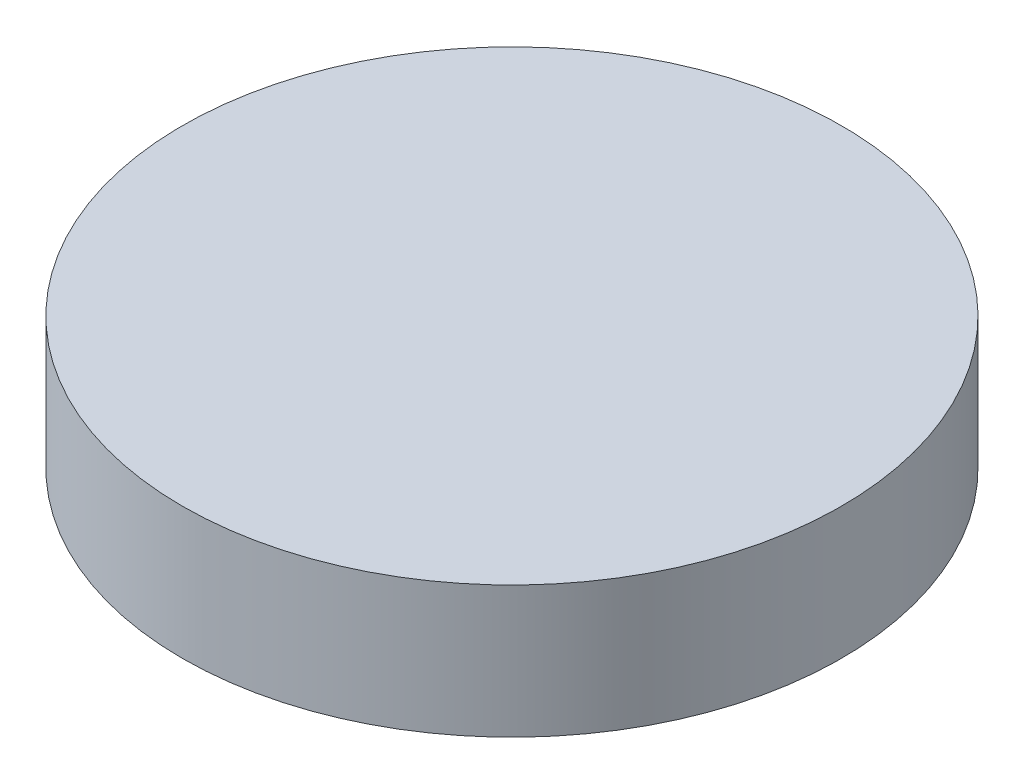
from build123d import *

# Parameters (mm, degrees)
SKETCH_1_R      = 10
EXTRUDE_1_DEPTH = 4


with BuildPart() as part:
    # Эскиз1 → Бобышка-Вытянуть1 (new body)
    with BuildSketch(Plane(origin=(0, 0, 0), x_dir=(1, 0, 0), z_dir=(0, 1, 0))):
        with Locations(Location((0, 0, 0), (0, 0, 270))):
            Circle(SKETCH_1_R)
    extrude(amount=EXTRUDE_1_DEPTH)


solid = part.part
